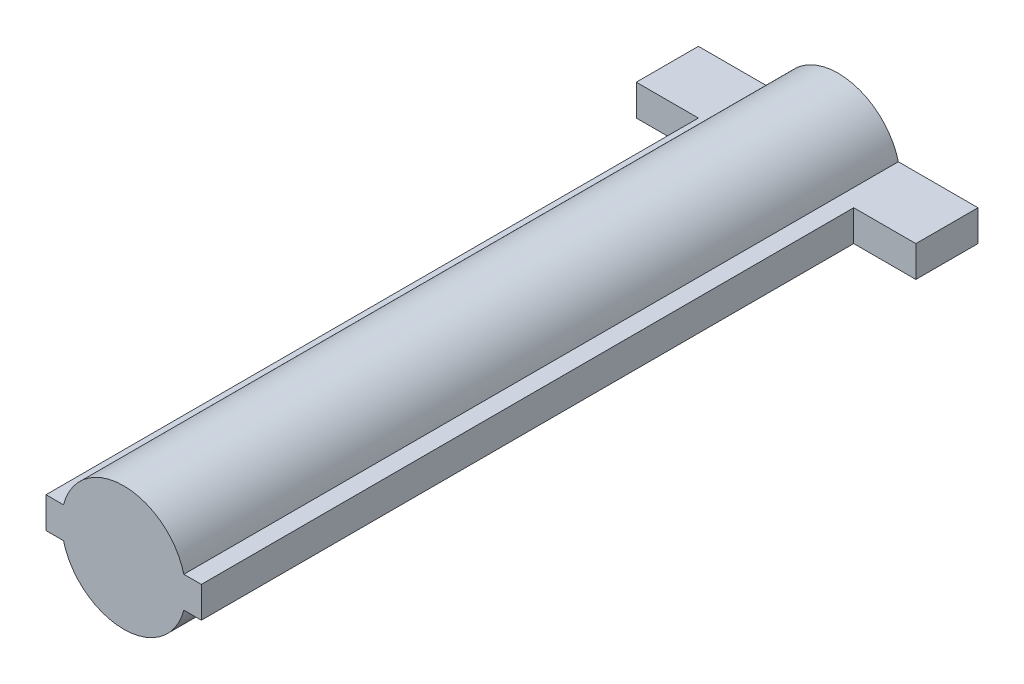
from build123d import *

# Parameters (mm, degrees)
BOSS_EXTRUDE2_DEPTH = 2
BOSS_EXTRUDE4_DEPTH = 21
BOSS_EXTRUDE3_DEPTH = 20


with BuildPart() as part:
    # Sketch1 → Boss-Extrude2 (new body)
    with BuildSketch(Plane.XY):
        with BuildLine():
            Line((1.936491673, 0.5), (4.5, 0.5))
            Line((4.5, 0.5), (4.5, -0.5))
            Line((4.5, -0.5), (1.936491673, -0.5))
            ThreePointArc((1.936491673, -0.5), (0, -2), (-1.936491673, -0.5))
            Line((-1.936491673, -0.5), (-4.5, -0.5))
            Line((-4.5, -0.5), (-4.5, 0.5))
            Line((-4.5, 0.5), (-1.936491673, 0.5))
            ThreePointArc((-1.936491673, 0.5), (0, 2), (1.936491673, 0.5))
        make_face()
    extrude(amount=BOSS_EXTRUDE2_DEPTH)

    # Sketch2<2> → Boss-Extrude4 (add)
    with BuildSketch(Plane.XY.offset(2)):
        with BuildLine():
            Line((1.936491673, 0.5), (2.5, 0.5))
            Line((2.5, 0.5), (2.5, -0.5))
            Line((2.5, -0.5), (1.936491673, -0.5))
            ThreePointArc((1.936491673, -0.5), (0, -2), (-1.936491673, -0.5))
            Line((-1.936491673, -0.5), (-2.5, -0.5))
            Line((-2.5, -0.5), (-2.5, 0.5))
            Line((-2.5, 0.5), (-1.936491673, 0.5))
            ThreePointArc((-1.936491673, 0.5), (0, 2), (1.936491673, 0.5))
        make_face()
    extrude(amount=BOSS_EXTRUDE4_DEPTH)

    # Sketch2 → Boss-Extrude3 (add)
    with BuildSketch(Plane.XY.offset(2)):
        with BuildLine():
            Line((1.936491673, 0.5), (2.5, 0.5))
            Line((2.5, 0.5), (2.5, -0.5))
            Line((2.5, -0.5), (1.936491673, -0.5))
            ThreePointArc((1.936491673, -0.5), (0, -2), (-1.936491673, -0.5))
            Line((-1.936491673, -0.5), (-2.5, -0.5))
            Line((-2.5, -0.5), (-2.5, 0.5))
            Line((-2.5, 0.5), (-1.936491673, 0.5))
            ThreePointArc((-1.936491673, 0.5), (0, 2), (1.936491673, 0.5))
        make_face()
    extrude(amount=BOSS_EXTRUDE3_DEPTH)


solid = part.part
